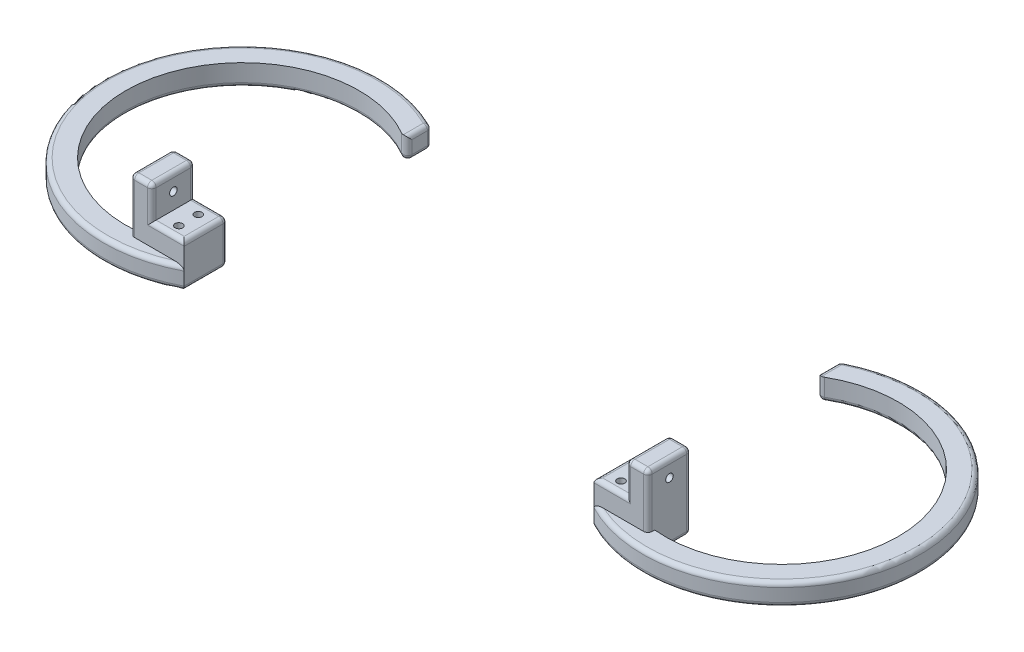
from build123d import *

# Parameters (mm, degrees)
BOSS_EXTRUDE1_DEPTH  = 10
SKETCH2_W            = 20
SKETCH2_H            = 10
BOSS_EXTRUDE2_DEPTH  = 15
SKETCH3_W            = 20
SKETCH3_H            = 15
BOSS_EXTRUDE10_DEPTH = 10
SKETCH4_W            = 10
SKETCH4_H            = 20
BOSS_EXTRUDE11_DEPTH = 10
SKETCH12_W           = 10
SKETCH12_H           = 20
BOSS_EXTRUDE16_DEPTH = 10
SKETCH10_W           = 15
SKETCH10_H           = 20
BOSS_EXTRUDE17_DEPTH = 10
CUT_EXTRUDE1_REACH   = 102.43
SKETCH14_R           = 1.75
CUT_EXTRUDE2_REACH   = 107.263
SKETCH15_R           = 1.75
FILLET1_R            = 2


with BuildPart() as part:
    # Sketch1 → Boss-Extrude1 (new body)
    with BuildSketch(Plane(origin=(0, 0, 0), x_dir=(1, 0, 0), z_dir=(0, 1, 0))):
        with BuildLine():
            Line((-20, 45), (-20, 57))
            ThreePointArc((-20, 57), (74.412731661, 0), (-20, -57))
            Line((-20, -57), (-20, -45))
            ThreePointArc((-20, -45), (64.083269132, 0), (-20, 45))
        make_face()
    extrude(amount=-BOSS_EXTRUDE1_DEPTH)

    # Sketch2 → Boss-Extrude2 (add)
    with BuildSketch(Plane.ZY.offset(20)):
        with Locations((47, -5)):
            Rectangle(SKETCH2_W, SKETCH2_H)
    extrude(amount=-BOSS_EXTRUDE2_DEPTH)



with BuildPart() as body_2:
    # Sketch3 → Boss-Extrude10 (new body)
    with BuildSketch(Plane(origin=(-5, 0, 0), x_dir=(0, 0, -1), z_dir=(1, 0, 0))):
        with Locations((-47, 7.5)):
            Rectangle(SKETCH3_W, SKETCH3_H)
    extrude(amount=BOSS_EXTRUDE10_DEPTH)


with BuildPart() as part_1:
    add(part.part)

    add(body_2.part)  # Boss-Extrude11 merges body 2
    # Sketch4 → Boss-Extrude11 (add)
    with BuildSketch(Plane(origin=(0, 0, 0), x_dir=(-1, 0, 0), z_dir=(0, -1, 0))):
        with Locations((0, -47)):
            Rectangle(SKETCH4_W, SKETCH4_H)
    extrude(amount=BOSS_EXTRUDE11_DEPTH)

    # Sketch12 → Boss-Extrude16 (add)
    with BuildSketch(Plane(origin=(0, 15, 0), x_dir=(1, 0, 0), z_dir=(0, 1, 0))):
        with Locations((0, -47)):
            Rectangle(SKETCH12_W, SKETCH12_H)
    extrude(amount=BOSS_EXTRUDE16_DEPTH)

    # Sketch10 → Boss-Extrude17 (add)
    with BuildSketch(Plane(origin=(0, 0, 0), x_dir=(1, 0, 0), z_dir=(0, 1, 0))):
        with Locations((-12.5, -47)):
            Rectangle(SKETCH10_W, SKETCH10_H)
    extrude(amount=BOSS_EXTRUDE17_DEPTH)

    # Sketch14 → Cut-Extrude1 (cut, up to next)
    with BuildSketch(Plane(origin=(0, 10, 0), x_dir=(1, 0, 0), z_dir=(0, 1, 0)), mode=Mode.PRIVATE) as cut_extrude1_sk1:
        with Locations(Location((-12.5, -43, 0), (0, 0, 270))):
            Circle(SKETCH14_R)
    cut_extrude1_tool1 = extrude(cut_extrude1_sk1.sketch, amount=-CUT_EXTRUDE1_REACH, mode=Mode.PRIVATE) & part_1.part
    # Sketch14 → Cut-Extrude1 (cut, up to next)
    with BuildSketch(Plane(origin=(0, 10, 0), x_dir=(1, 0, 0), z_dir=(0, 1, 0)), mode=Mode.PRIVATE) as cut_extrude1_sk2:
        with Locations(Location((-12.5, -52, 0), (0, 0, 270))):
            Circle(SKETCH14_R)
    cut_extrude1_tool2 = extrude(cut_extrude1_sk2.sketch, amount=-CUT_EXTRUDE1_REACH, mode=Mode.PRIVATE) & part_1.part
    add(cut_extrude1_tool1.solids().sort_by_distance((-12.5, 10, 43))[0], mode=Mode.SUBTRACT)
    add(cut_extrude1_tool2.solids().sort_by_distance((-12.5, 10, 52))[0], mode=Mode.SUBTRACT)

    # Sketch15 → Cut-Extrude2 (cut, up to next)
    with BuildSketch(Plane.ZY.offset(5), mode=Mode.PRIVATE) as cut_extrude2_sk1:
        with Locations((47, 17.5)):
            Circle(SKETCH15_R)
    cut_extrude2_tool1 = extrude(cut_extrude2_sk1.sketch, amount=-CUT_EXTRUDE2_REACH, mode=Mode.PRIVATE) & part_1.part
    add(cut_extrude2_tool1.solids().sort_by_distance((-5, 17.5, 47))[0], mode=Mode.SUBTRACT)

    # Fillet1
    fillet1_edges = [part_1.edges().sort_by_distance(p)[0] for p in [
        (74.412731661, -10, 0),
        (-20, -10, -51),
        (-7.5, -10, 37),
        (-20, 0, 37),
        (5, 7.5, 37),
        (62.432452561, -10, -13.260389074),
        (5, -10, 45.425824036),
        (-20, 0, -51),
        (74.412731661, 0, 0),
        (-5, 17.5, 57),
        (5, 12.5, 57),
        (5, 25, 47),
        (0, 25, 37),
        (-5, 25, 47),
        (0, 25, 57),
        (-20, -10, 47),
        (-5, 17.5, 37),
        (-20, -5, -45),
        (-20, -5, -57),
        (-20, 10, 47),
        (-12.5, 10, 57),
        (-12.5, 10, 37),
    ]]
    fillet(fillet1_edges, radius=FILLET1_R)


with BuildPart() as body_2_2:
    # Mirror2: mirrored copy
    add(part_1.part.mirror(Plane.ZY.offset(115)))


solid = Compound([part_1.part, body_2_2.part])
